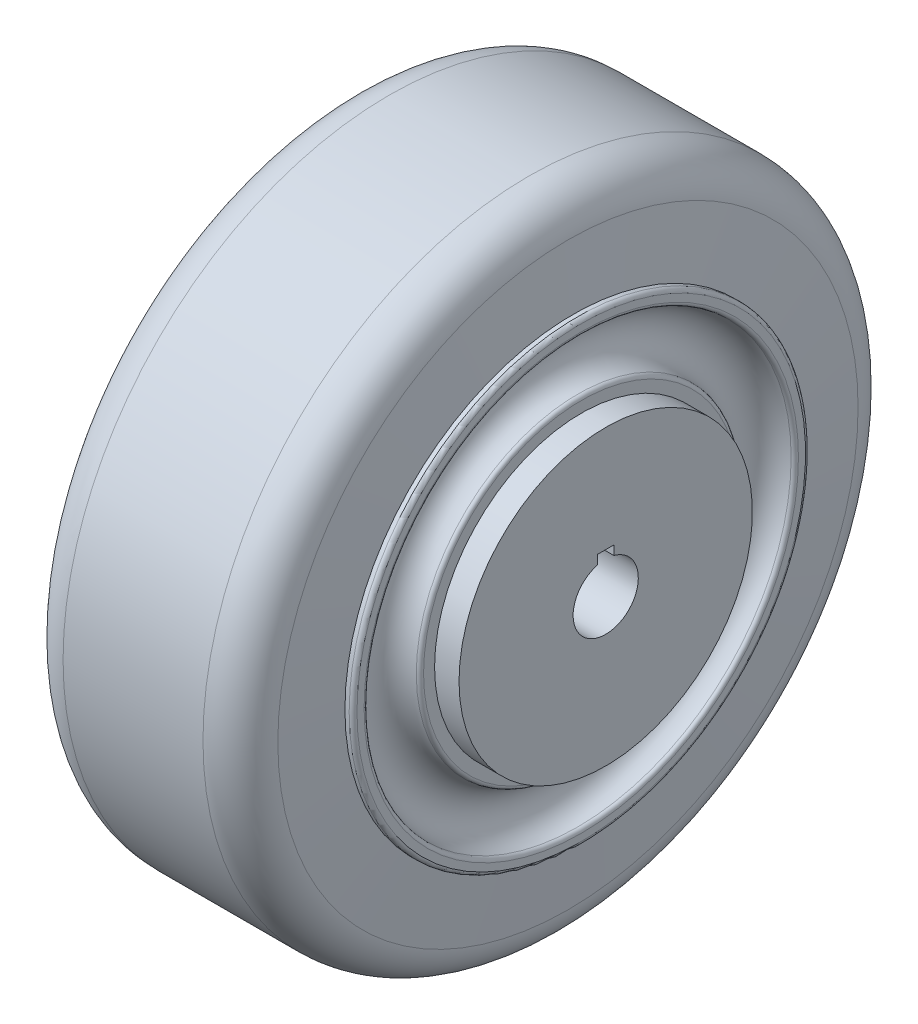
from build123d import *

# Parameters (mm, degrees)
FILLET1_R          = 7.62
FILLET2_R          = 0.762
SKETCH3_W          = 3.175
SKETCH3_H          = 3.175
CUT_EXTRUDE1_DEPTH = 107.445397956


with BuildPart() as part:
    # Sketch1 → Revolve1 (revolve)
    with BuildSketch(Plane.XY, mode=Mode.PRIVATE) as revolve1_sk:
        with BuildLine():
            Line((0, 6.35), (0, 28.575))
            Line((0, 28.575), (4.7625, 28.575))
            Line((4.7625, 28.575), (4.7625, 31.4325))
            ThreePointArc((4.7625, 31.4325), (9.8425, 36.5125), (4.7625, 41.5925))
            Line((4.7625, 41.5925), (4.7625, 44.45))
            Line((4.7625, 44.45), (6.35, 44.45))
            Line((6.35, 44.45), (7.9375, 63.5))
            Line((7.9375, 63.5), (49.2125, 63.5))
            Line((49.2125, 63.5), (50.8, 44.45))
            Line((50.8, 44.45), (52.3875, 44.45))
            Line((52.3875, 44.45), (52.3875, 41.5925))
            ThreePointArc((52.3875, 41.5925), (47.3075, 36.5125), (52.3875, 31.4325))
            Line((52.3875, 31.4325), (52.3875, 28.575))
            Line((52.3875, 28.575), (57.15, 28.575))
            Line((57.15, 28.575), (57.15, 6.35))
            Line((57.15, 6.35), (0, 6.35))
        make_face()
    revolve(revolve1_sk.sketch.rotate(Axis((0, 0, 0), (1, 0, 0)), 90), axis=Axis((0, 0, 0), (1, 0, 0)))

    # Fillet1
    fillet1_edges = [part.edges().sort_by_distance(p)[0] for p in [
        (7.9375, 0, -63.5),
        (49.2125, 0, -63.5),
    ]]
    fillet(fillet1_edges, radius=FILLET1_R)

    # Fillet2
    fillet2_edges = [part.edges().sort_by_distance(p)[0] for p in [
        (4.7625, 0, -31.4325),
        (4.7625, 0, -41.5925),
        (4.7625, 0, -44.45),
        (52.3875, 0, -44.45),
        (52.3875, 0, -41.5925),
        (52.3875, 0, -31.4325),
    ]]
    fillet(fillet2_edges, radius=FILLET2_R)

    # Sketch3 → Cut-Extrude1 (cut, through all)
    with BuildSketch(Plane.ZY):
        with Locations((0, 6.35)):
            Rectangle(SKETCH3_W, SKETCH3_H)
    extrude(amount=-CUT_EXTRUDE1_DEPTH, mode=Mode.SUBTRACT)


solid = part.part
